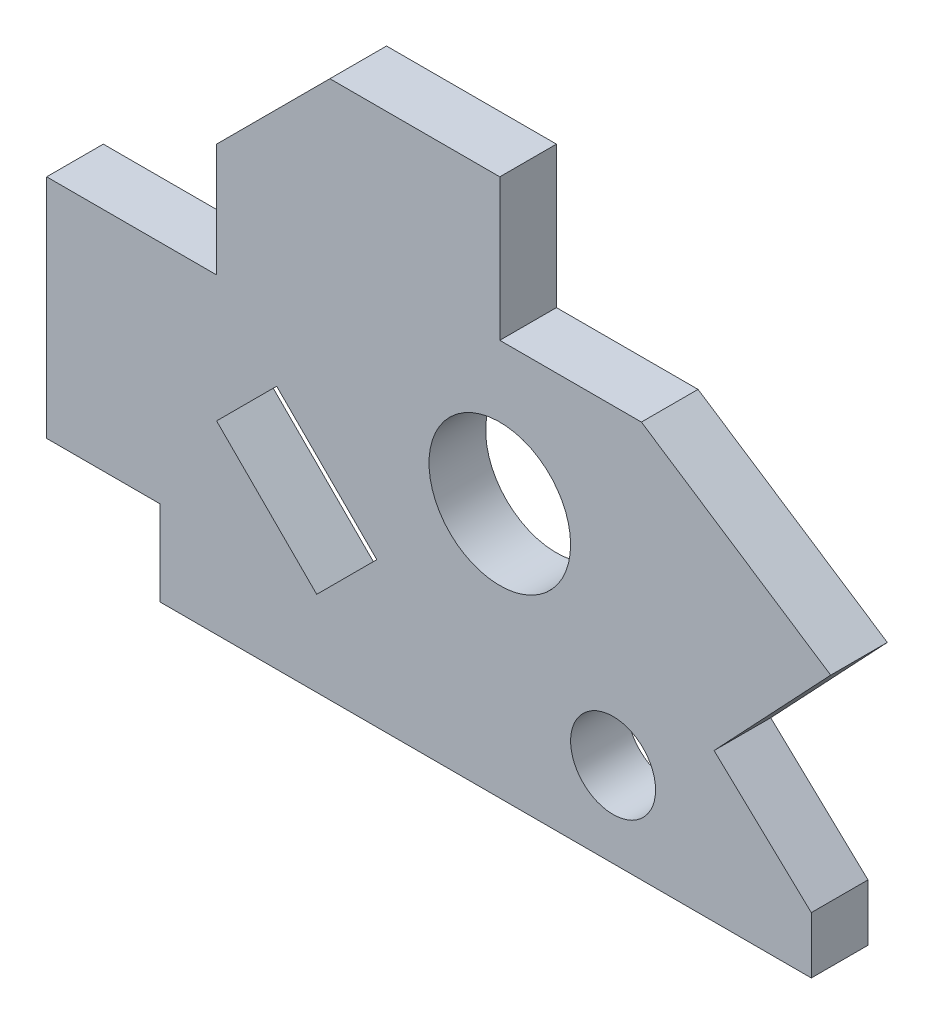
from build123d import *

# Parameters (mm, degrees)
CROQUIS1_R              = 12.5
CROQUIS1_R_2            = 7.5
SALIENTE_EXTRUIR1_DEPTH = 10


with BuildPart() as part:
    # Croquis1 → Saliente-Extruir1 (new body)
    with BuildSketch(Plane.XY):
        Polygon((0, 0), (-115, 0), (-115, 15), (-135, 15), (-135, 55), (-105, 55), (-105, 75), (-85, 95), (-55, 95), (-55, 70), (-30, 70), (3.419129876, 48.019059203), (-17.168499063, 26.198208287), (0, 10), align=None)
        with Locations((-55, 45)):
            Circle(CROQUIS1_R, mode=Mode.SUBTRACT)
        with Locations((-35, 15)):
            Circle(CROQUIS1_R_2, mode=Mode.SUBTRACT)
        Polygon((-105, 32.67766953), (-87.32233047, 15), (-76.715728753, 25.606601718), (-94.393398282, 43.284271247), align=None, mode=Mode.SUBTRACT)
    extrude(amount=SALIENTE_EXTRUIR1_DEPTH)


solid = part.part
